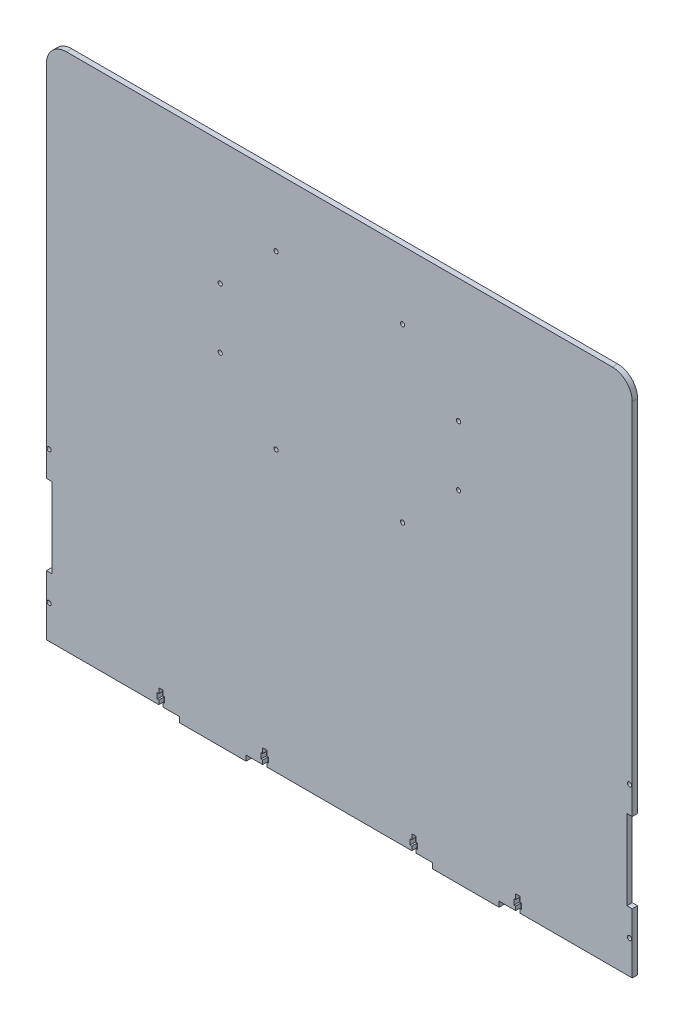
from build123d import *

# Parameters (mm, degrees)
ESQUISSE1_W             = 440
ESQUISSE1_H             = 390
BOSS_EXTRU_1_DEPTH      = 4
ESQUISSE2_W             = 50
ESQUISSE2_H             = 4
BOSS_EXTRU_2_DEPTH      = 4
ESQUISSE3_W             = 4
ESQUISSE3_H             = 60
ENL_V_MAT_EXTRU_1_DEPTH = 4
CONG_1_R                = 15
ESQUISSE4_R             = 1.6
ENL_V_MAT_EXTRU_2_DEPTH = 10
ESQUISSE5_R             = 1.6
ENL_V_MAT_EXTRU_3_DEPTH = 4


with BuildPart() as part:
    # Esquisse1 → Boss.-Extru.1 (new body)
    with BuildSketch(Plane.XY):
        Rectangle(ESQUISSE1_W, ESQUISSE1_H)
    extrude(amount=BOSS_EXTRU_1_DEPTH)

    # Esquisse2 → Boss.-Extru.2 (add)
    with BuildSketch(Plane(origin=(0, 0, 0), x_dir=(-1, 0, 0), z_dir=(0, 0, -1))):
        with Locations((-95, -197)):
            Rectangle(ESQUISSE2_W, ESQUISSE2_H)
        with Locations((95, -197)):
            Rectangle(ESQUISSE2_W, ESQUISSE2_H)
    extrude(amount=-BOSS_EXTRU_2_DEPTH)

    # Esquisse3 → Enlèv. mat.-Extru.1 (cut)
    with BuildSketch(Plane(origin=(0, 0, 0), x_dir=(-1, 0, 0), z_dir=(0, 0, -1))):
        with Locations((-218, -120)):
            Rectangle(ESQUISSE3_W, ESQUISSE3_H)
        with Locations((218, -120)):
            Rectangle(ESQUISSE3_W, ESQUISSE3_H)
    extrude(amount=-ENL_V_MAT_EXTRU_1_DEPTH, mode=Mode.SUBTRACT)

    # Congé1
    cong_1_edges = [part.edges().sort_by_distance(p)[0] for p in [
        (-220, 195, 2),
        (220, 195, 2),
    ]]
    fillet(cong_1_edges, radius=CONG_1_R)

    # Esquisse4 → Enlèv. mat.-Extru.2 (cut)
    with BuildSketch(Plane(origin=(0, 0, 0), x_dir=(-1, 0, 0), z_dir=(0, 0, -1))):
        Polygon((-132.4, -195), (-132.4, -192), (-131.15, -192), (-131.15, -187.8), (-132.4, -187.8), (-132.4, -184), (-135.6, -184), (-135.6, -187.8), (-136.85, -187.8), (-136.85, -192), (-135.6, -192), (-135.6, -195), align=None)
        Polygon((-57.6, -192), (-57.6, -195), (-54.4, -195), (-54.4, -192), (-53.15, -192), (-53.15, -187.8), (-54.4, -187.8), (-54.4, -184), (-57.6, -184), (-57.6, -187.8), (-58.85, -187.8), (-58.85, -192), align=None)
        with Locations((-218, -170)):
            Circle(ESQUISSE4_R)
        with Locations((-218, -70)):
            Circle(ESQUISSE4_R)
        with Locations((218, -70)):
            Circle(ESQUISSE4_R)
        with Locations((218, -170)):
            Circle(ESQUISSE4_R)
        Polygon((54.4, -192), (54.4, -195), (57.6, -195), (57.6, -192), (58.85, -192), (58.85, -187.8), (57.6, -187.8), (57.6, -184), (54.4, -184), (54.4, -187.8), (53.15, -187.8), (53.15, -192), align=None)
        Polygon((135.6, -187.8), (135.6, -184), (132.4, -184), (132.4, -187.8), (131.15, -187.8), (131.15, -192), (132.4, -192), (132.4, -195), (135.6, -195), (135.6, -192), (136.85, -192), (136.85, -187.8), align=None)
    extrude(amount=-ENL_V_MAT_EXTRU_2_DEPTH, mode=Mode.SUBTRACT)

    # Esquisse5 → Enlèv. mat.-Extru.3 (cut)
    with BuildSketch(Plane(origin=(0, 0, 0), x_dir=(-1, 0, 0), z_dir=(0, 0, -1))):
        with Locations((-47.5, 144.040872052)):
            Circle(ESQUISSE5_R)
        with Locations((-89.5, 102.040872052)):
            Circle(ESQUISSE5_R)
        with Locations((-89.5, 57.040872052)):
            Circle(ESQUISSE5_R)
        with Locations((-47.5, 15.040872052)):
            Circle(ESQUISSE5_R)
        with Locations((89.5, 57.040872052)):
            Circle(ESQUISSE5_R)
        with Locations((47.5, 15.040872052)):
            Circle(ESQUISSE5_R)
        with Locations((47.5, 144.040872052)):
            Circle(ESQUISSE5_R)
        with Locations((89.5, 102.040872052)):
            Circle(ESQUISSE5_R)
    extrude(amount=-ENL_V_MAT_EXTRU_3_DEPTH, mode=Mode.SUBTRACT)


solid = part.part
